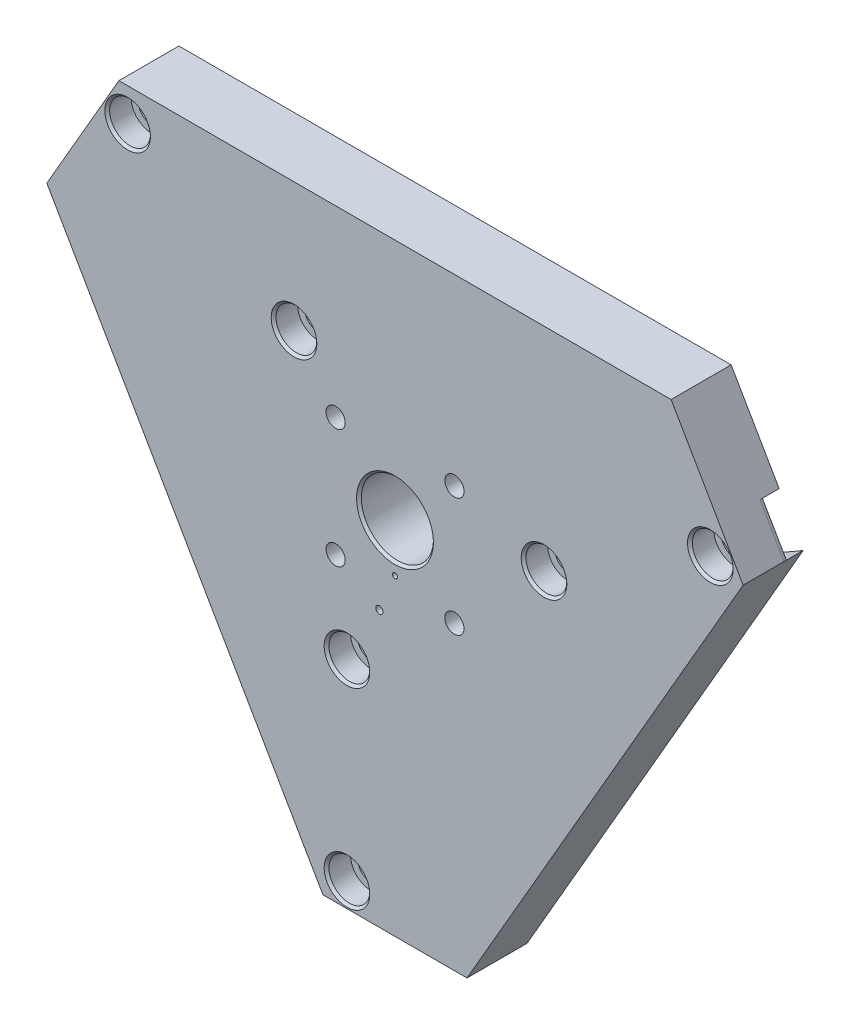
from build123d import *

# Parameters (mm, degrees)
SKETCH_1_R                   = 15
EXTRUDE_1_DEPTH              = 25
SKETCH_5_W                   = 20
SKETCH_5_H                   = 120
CUT_EXTRUDE_1_DEPTH          = 6
FILLET_1_R                   = 5
FILLET_2_R                   = 5
FILLET_3_R                   = 5
FILLET_4_R                   = 5
FILLET_5_R                   = 5
FILLET_6_R                   = 5
SKETCH_7_R                   = 5.5
CUT_EXTRUDE_2_DEPTH          = 270.256549022
SKETCH_8_R                   = 8.5
CUT_EXTRUDE_3_DEPTH          = 10
HOLE_WIZARD_M8_1_D           = 6.8
HOLE_WIZARD_M8_1_DEPTH       = 9.75
HOLE_WIZARD_M8_1_CBORE_D     = 8
HOLE_WIZARD_M8_1_CBORE_DEPTH = 6
HOLE_WIZARD_M8_1_TIP         = 2.042926105
HOLE_WIZARD_M8_2_D           = 6.8
HOLE_WIZARD_M8_2_DEPTH       = 9.75
HOLE_WIZARD_M8_2_CBORE_D     = 8
HOLE_WIZARD_M8_2_CBORE_DEPTH = 6
HOLE_WIZARD_M8_2_TIP         = 2.042926105
FILLET_7_R                   = 2
CHAMFER_1_SIZE               = 2
CHAMFER_2_SIZE               = 1
CHAMFER_3_SIZE               = 1
HOLE_WIZARD_M3_1_D           = 2.5
HOLE_WIZARD_M3_1_DEPTH       = 7.5
HOLE_WIZARD_M3_1_CBORE_D     = 3
HOLE_WIZARD_M3_1_CBORE_DEPTH = 6
HOLE_WIZARD_M3_1_TIP         = 0.751075774
SKETCH_15_R                  = 1.05
CUT_EXTRUDE_4_DEPTH          = 10


with BuildPart() as part:
    # 草图1 → 拉伸1 (new body)
    with BuildSketch(Plane.XY):
        Polygon((-107.694965591, 220.629249387), (-137.694965591, 168.66772516), (-22.694965591, -30.518117711), (37.305034409, -30.518117711), (152.305034409, 168.66772516), (122.305034409, 220.629249387), align=None)
        with Locations((7.305034409, 119.592952279)):
            Circle(SKETCH_1_R, mode=Mode.SUBTRACT)
    extrude(amount=EXTRUDE_1_DEPTH)

    # 草图5 → 切除-拉伸1 (cut)
    with BuildSketch(Plane(origin=(0, 0, 0), x_dir=(-1, 0, 0), z_dir=(0, 0, -1))):
        Polygon((26.762298194, 150.808741311), (130.669741536, 210.799731695), (125.132108132, 230.696588327), (16.762298194, 168.129249387), align=None)
        Polygon((-170.362424446, 179.093164159), (-61.372367011, 116.16772516), (-51.372367011, 133.488233235), (-160.362424446, 196.413672234), align=None)
        with Locations((12.694965591, 14.481882289)):
            Rectangle(SKETCH_5_W, SKETCH_5_H)
    extrude(amount=-CUT_EXTRUDE_1_DEPTH, mode=Mode.SUBTRACT)

    # 圆角1
    fillet_1_edges = [part.edges().sort_by_distance(p)[0] for p in [
        (-16.762298194, 168.129249387, 3),
    ]]
    fillet(fillet_1_edges, radius=FILLET_1_R)

    # 圆角2
    fillet_2_edges = [part.edges().sort_by_distance(p)[0] for p in [
        (-26.762298194, 150.808741311, 3),
    ]]
    fillet(fillet_2_edges, radius=FILLET_2_R)

    # 圆角3
    fillet_3_edges = [part.edges().sort_by_distance(p)[0] for p in [
        (61.372367011, 116.16772516, 3),
    ]]
    fillet(fillet_3_edges, radius=FILLET_3_R)

    # 圆角4
    fillet_4_edges = [part.edges().sort_by_distance(p)[0] for p in [
        (51.372367011, 133.488233235, 3),
    ]]
    fillet(fillet_4_edges, radius=FILLET_4_R)

    # 圆角5
    fillet_5_edges = [part.edges().sort_by_distance(p)[0] for p in [
        (-22.694965591, 74.481882289, 3),
    ]]
    fillet(fillet_5_edges, radius=FILLET_5_R)

    # 圆角6
    fillet_6_edges = [part.edges().sort_by_distance(p)[0] for p in [
        (-2.694965591, 74.481882289, 3),
    ]]
    fillet(fillet_6_edges, radius=FILLET_6_R)

    # 草图7 → 切除-拉伸2 (cut, through all)
    with BuildSketch(Plane(origin=(0, 0, 0), x_dir=(-1, 0, 0), z_dir=(0, 0, -1))):
        with Locations((104.034711553, 206.968995349)):
            Circle(SKETCH_7_R)
        with Locations((34.752679251, 166.968995349)):
            Circle(SKETCH_7_R)
        with Locations((-138.644780371, 172.327979198)):
            Circle(SKETCH_7_R)
        with Locations((-69.362748068, 132.327979198)):
            Circle(SKETCH_7_R)
        with Locations((12.694965591, 59.481882289)):
            Circle(SKETCH_7_R)
        with Locations((12.694965591, -20.518117711)):
            Circle(SKETCH_7_R)
    extrude(amount=-CUT_EXTRUDE_2_DEPTH, mode=Mode.SUBTRACT)

    # 草图8 → 切除-拉伸3 (cut)
    with BuildSketch(Plane.XY.offset(25)):
        with Locations((-12.694965591, 59.481882289)):
            Circle(SKETCH_8_R)
        with Locations((-12.694965591, -20.518117711)):
            Circle(SKETCH_8_R)
        with Locations((69.362748068, 132.327979198)):
            Circle(SKETCH_8_R)
        with Locations((138.644780371, 172.327979198)):
            Circle(SKETCH_8_R)
        with Locations((-34.752679251, 166.968995349)):
            Circle(SKETCH_8_R)
        with Locations((-104.034711553, 206.968995349)):
            Circle(SKETCH_8_R)
    extrude(amount=-CUT_EXTRUDE_3_DEPTH, mode=Mode.SUBTRACT)

    # M8 螺纹孔1
    with Locations(Plane(origin=(0, 0, 0), x_dir=(-1, 0, 0), z_dir=(0, 0, -1))):
        with Locations((-42.305034409, 119.592952279), (-7.305034409, 154.592952279), (27.694965591, 119.592952279), (-7.305034409, 84.592952279)):
            CounterBoreHole(HOLE_WIZARD_M8_1_D / 2, HOLE_WIZARD_M8_1_CBORE_D / 2, HOLE_WIZARD_M8_1_CBORE_DEPTH, depth=HOLE_WIZARD_M8_1_DEPTH)
            with Locations((0, 0, -(HOLE_WIZARD_M8_1_DEPTH + HOLE_WIZARD_M8_1_TIP / 2))):  # 118° drill point
                Cone(0, HOLE_WIZARD_M8_1_D / 2, HOLE_WIZARD_M8_1_TIP, mode=Mode.SUBTRACT)

    # M8 螺纹孔2
    with Locations(Plane.XY.offset(25)):
        with Locations((32.05377175, 94.844214937), (32.05377175, 144.34168962), (-17.410599553, 144.374748781), (-17.410599553, 94.811155776)):
            CounterBoreHole(HOLE_WIZARD_M8_2_D / 2, HOLE_WIZARD_M8_2_CBORE_D / 2, HOLE_WIZARD_M8_2_CBORE_DEPTH, depth=HOLE_WIZARD_M8_2_DEPTH)
            with Locations((0, 0, -(HOLE_WIZARD_M8_2_DEPTH + HOLE_WIZARD_M8_2_TIP / 2))):  # 118° drill point
                Cone(0, HOLE_WIZARD_M8_2_D / 2, HOLE_WIZARD_M8_2_TIP, mode=Mode.SUBTRACT)

    # 圆角7
    fillet_7_edges = [part.edges().sort_by_distance(p)[0] for p in [
        (147.305034409, 177.327979198, 6),
        (-112.694965591, 211.968995349, 6),
        (-12.694965591, -30.518117711, 6),
    ]]
    fillet(fillet_7_edges, radius=FILLET_7_R)

    # 倒角1
    chamfer_1_edges = [part.edges().sort_by_distance(p)[0] for p in [
        (-7.694965591, 119.592952279, 0),
    ]]
    chamfer(chamfer_1_edges, length=CHAMFER_1_SIZE)

    # 倒角2
    chamfer_2_edges = [part.edges().sort_by_distance(p)[0] for p in [
        (-112.534711553, 206.968995349, 25),
    ]]
    chamfer(chamfer_2_edges, length=CHAMFER_2_SIZE)

    # 倒角3
    chamfer_3_edges = [part.edges().sort_by_distance(p)[0] for p in [
        (-21.194965591, 59.481882289, 25),
        (-21.194965591, -20.518117711, 25),
        (60.862748068, 132.327979198, 25),
        (130.144780371, 172.327979198, 25),
        (-7.694965591, 119.592952279, 25),
        (-43.252679251, 166.968995349, 25),
    ]]
    chamfer(chamfer_3_edges, length=CHAMFER_3_SIZE)

    # M3 螺纹孔1
    with Locations(Plane(origin=(0.805034409, 83.992952279, 25), x_dir=(1, 0, 0), z_dir=(0, 0, 1))):
        with Locations((0, 0)):
            CounterBoreHole(HOLE_WIZARD_M3_1_D / 2, HOLE_WIZARD_M3_1_CBORE_D / 2, HOLE_WIZARD_M3_1_CBORE_DEPTH, depth=HOLE_WIZARD_M3_1_DEPTH)
            with Locations((0, 0, -(HOLE_WIZARD_M3_1_DEPTH + HOLE_WIZARD_M3_1_TIP / 2))):  # 118° drill point
                Cone(0, HOLE_WIZARD_M3_1_D / 2, HOLE_WIZARD_M3_1_TIP, mode=Mode.SUBTRACT)

    # 草图15 → 切除-拉伸4 (cut)
    with BuildSketch(Plane.XY.offset(25)):
        with Locations((7.305034409, 99.592952279)):
            Circle(SKETCH_15_R)
    extrude(amount=-CUT_EXTRUDE_4_DEPTH, mode=Mode.SUBTRACT)


solid = part.part
